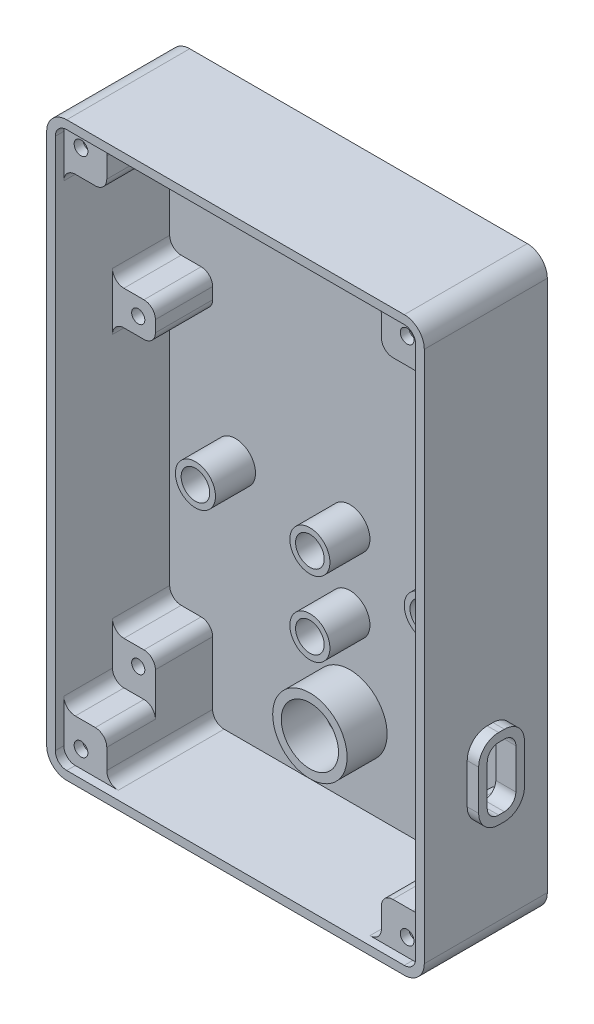
from build123d import *

# Parameters (mm, degrees)
SKETCH_1_W              = 66
SKETCH_1_H              = 100
SKETCH_1_W_2            = 63
SKETCH_1_H_2            = 97
EXTRUDE_1_DEPTH         = 20
SKETCH_3_W              = 66
SKETCH_3_H              = 100
EXTRUDE_2_DEPTH         = 1.5
SKETCH_4_W              = 7.5
SKETCH_4_H              = 6
SKETCH_4_H_2            = 7.5
EXTRUDE_3_DEPTH         = 10
HOLE_WIZARD_M2_21_D     = 2.3
HOLE_WIZARD_M2_21_DEPTH = 4
HOLE_WIZARD_M2_21_TIP   = 0.690989712
SKETCH_8_W              = 7.5
SKETCH_8_H              = 7.5
EXTRUDE_4_DEPTH         = 18.5
FILLET_1_R              = 2
FILLET_3_R              = 2
FILLET_4_R              = 3.5
SKETCH_9_R              = 2.5
SKETCH_9_R_2            = 3.5
CUT_EXTRUDE_1_DEPTH     = 64.158530699
EXTRUDE_START           = 7
SKETCH_10_R             = 3.5
SKETCH_10_R_2           = 2.5
EXTRUDE_5_DEPTH         = 7
SKETCH_11_R             = 2.5
CUT_EXTRUDE_2_DEPTH     = 18.5
HOLE_WIZARD_M21_D       = 2.4
SKETCH_15_W             = 5
SKETCH_15_H             = 11
CUT_EXTRUDE_3_DEPTH     = 85.025293811
FILLET_5_R              = 2
SKETCH_16_R             = 6.5
SKETCH_16_R_2           = 5
EXTRUDE_6_DEPTH         = 7
EXTRUDE_START_2         = 2
EXTRUDE_7_DEPTH         = 2


with BuildPart() as part:
    # Эскиз1 → Бобышка-Вытянуть1 (new body)
    with BuildSketch(Plane.XY):
        Rectangle(SKETCH_1_W, SKETCH_1_H)
        Rectangle(SKETCH_1_W_2, SKETCH_1_H_2, mode=Mode.SUBTRACT)
    extrude(amount=EXTRUDE_1_DEPTH)

    # Эскиз3 → Бобышка-Вытянуть2 (add)
    with BuildSketch(Plane(origin=(0, 0, 0), x_dir=(-1, 0, 0), z_dir=(0, 0, -1))):
        Rectangle(SKETCH_3_W, SKETCH_3_H)
    extrude(amount=EXTRUDE_2_DEPTH)

    # Эскиз4 → Бобышка-Вытянуть3 (add)
    with BuildSketch(Plane.XY):
        with Locations((-27.75, 16.5)):
            Rectangle(SKETCH_4_W, SKETCH_4_H)
        with Locations((27.75, 16.5)):
            Rectangle(SKETCH_4_W, SKETCH_4_H)
        with Locations((-27.75, -37.25)):
            Rectangle(SKETCH_4_W, SKETCH_4_H_2)
        with Locations((27.75, -37.25)):
            Rectangle(SKETCH_4_W, SKETCH_4_H_2)
    extrude(amount=EXTRUDE_3_DEPTH)

    # Сверло под метчик  спиральное M2.21
    with Locations(Plane.XY.offset(10)):
        with Locations((-27, 16.5), (27, 16.5), (27, -36.5), (-27, -36.5)):
            Hole(HOLE_WIZARD_M2_21_D / 2, depth=HOLE_WIZARD_M2_21_DEPTH)
            with Locations((0, 0, -(HOLE_WIZARD_M2_21_DEPTH + HOLE_WIZARD_M2_21_TIP / 2))):  # 118° drill point
                Cone(0, HOLE_WIZARD_M2_21_D / 2, HOLE_WIZARD_M2_21_TIP, mode=Mode.SUBTRACT)

    # Эскиз8 → Бобышка-Вытянуть4 (add)
    with BuildSketch(Plane.XY):
        with Locations((-27.75, 44.75)):
            Rectangle(SKETCH_8_W, SKETCH_8_H)
        with Locations((27.75, 44.75)):
            Rectangle(SKETCH_8_W, SKETCH_8_H)
        with Locations((27.75, -44.75)):
            Rectangle(SKETCH_8_W, SKETCH_8_H)
        with Locations((-27.75, -44.75)):
            Rectangle(SKETCH_8_W, SKETCH_8_H)
    extrude(amount=EXTRUDE_4_DEPTH)

    # Скругление1
    fillet_1_edges = [part.edges().sort_by_distance(p)[0] for p in [
        (-31.5, 41, 9.25),
        (-24, 41, 9.25),
        (-24, 48.5, 9.25),
        (31.5, 41, 9.25),
        (24, 48.5, 9.25),
        (24, 41, 9.25),
        (24, -48.5, 9.25),
        (-24, -48.5, 9.25),
        (-31.5, 19.5, 5),
        (-31.5, 13.5, 5),
        (-24, 13.5, 5),
        (-24, 19.5, 5),
        (31.5, 13.5, 5),
        (31.5, 19.5, 5),
        (24, 19.5, 5),
        (24, 13.5, 5),
        (-31.5, -33.5, 5),
        (-24, -33.5, 5),
        (31.5, -33.5, 5),
        (24, -33.5, 5),
    ]]
    fillet(fillet_1_edges, radius=FILLET_1_R)

    # Скругление3
    fillet_3_edges = [part.edges().sort_by_distance(p)[0] for p in [
        (31.5, -41, 14.25),
        (24, -41, 14.25),
        (-24, -41, 14.25),
        (31.5, -48.5, 19.25),
        (-31.5, -41, 14.25),
        (31.5, 48.5, 19.25),
        (-31.5, 48.5, 19.25),
        (-31.5, -48.5, 19.25),
    ]]
    fillet(fillet_3_edges, radius=FILLET_3_R)

    # Скругление4
    fillet_4_edges = [part.edges().sort_by_distance(p)[0] for p in [
        (33, -50, 9.25),
        (-33, -50, 9.25),
        (-33, 50, 9.25),
        (33, 50, 9.25),
    ]]
    fillet(fillet_4_edges, radius=FILLET_4_R)

    # Эскиз9 → Вырез-Вытянуть1 (cut, through all)
    with BuildSketch(Plane.XY):
        with Locations((-20, -7)):
            Circle(SKETCH_9_R)
        with Locations((20, -7)):
            Circle(SKETCH_9_R)
        with Locations((0, -20)):
            Circle(SKETCH_9_R)
        with Locations((0, -7)):
            Circle(SKETCH_9_R)
        with Locations((0, -35)):
            Circle(SKETCH_9_R_2)
    extrude(amount=-CUT_EXTRUDE_1_DEPTH, mode=Mode.SUBTRACT)

    # Эскиз10 → Бобышка-Вытянуть5 (add)
    # profile 1 of 4: a face of its own
    with BuildSketch(Plane.XY.offset(EXTRUDE_START)):
        with Locations(Location((0, -7, 0), (0, 0, 180))):
            Circle(SKETCH_10_R)
        with Locations((0, -7)):
            Circle(SKETCH_10_R_2, mode=Mode.SUBTRACT)
    # profile 2 of 4: a face of its own
    with BuildSketch(Plane.XY.offset(EXTRUDE_START)):
        with Locations(Location((20, -7, 0), (0, 0, 180))):
            Circle(SKETCH_10_R)
        with Locations((20, -7)):
            Circle(SKETCH_10_R_2, mode=Mode.SUBTRACT)
    # profile 3 of 4: a face of its own
    with BuildSketch(Plane.XY.offset(EXTRUDE_START)):
        with Locations(Location((0, -20, 0), (0, 0, 180))):
            Circle(SKETCH_10_R)
        with Locations((0, -20)):
            Circle(SKETCH_10_R_2, mode=Mode.SUBTRACT)
    # profile 4 of 4: a face of its own
    with BuildSketch(Plane.XY.offset(EXTRUDE_START)):
        with Locations(Location((-20, -7, 0), (0, 0, 180))):
            Circle(SKETCH_10_R)
        with Locations((-20, -7)):
            Circle(SKETCH_10_R_2, mode=Mode.SUBTRACT)
    extrude(amount=-EXTRUDE_5_DEPTH)

    # Эскиз11 → Вырез-Вытянуть2 (cut)
    with BuildSketch(Plane(origin=(0, 0, -1.5), x_dir=(-1, 0, 0), z_dir=(0, 0, -1))):
        with Locations((-28.5, 45.5)):
            Circle(SKETCH_11_R)
        with Locations((28.5, 45.5)):
            Circle(SKETCH_11_R)
        with Locations((28.5, -45.5)):
            Circle(SKETCH_11_R)
        with Locations((-28.5, -45.5)):
            Circle(SKETCH_11_R)
    extrude(amount=-CUT_EXTRUDE_2_DEPTH, mode=Mode.SUBTRACT)

    # Отверстие с зазором M21 (through all)
    with Locations(Plane(origin=(0, 0, 17), x_dir=(-1, 0, 0), z_dir=(0, 0, -1))):
        with Locations((-28.5, 45.5), (28.5, 45.5), (28.5, -45.5), (-28.5, -45.5)):
            Hole(HOLE_WIZARD_M21_D / 2)

    # Эскиз15 → Вырез-Вытянуть3 (cut, through all)
    with BuildSketch(Plane.ZY.offset(-31.5)):
        with Locations((8.5, -23)):
            Rectangle(SKETCH_15_W, SKETCH_15_H)
    extrude(amount=-CUT_EXTRUDE_3_DEPTH, mode=Mode.SUBTRACT)

    # Скругление5
    fillet_5_edges = [part.edges().sort_by_distance(p)[0] for p in [
        (32.25, -28.5, 6),
        (32.25, -17.5, 6),
        (32.25, -17.5, 11),
        (32.25, -28.5, 11),
    ]]
    fillet(fillet_5_edges, radius=FILLET_5_R)

    # Эскиз16 → Бобышка-Вытянуть6 (add)
    with BuildSketch(Plane.XY):
        with Locations(Location((0, -35, 0), (0, 0, 180))):
            Circle(SKETCH_16_R)
        with Locations((0, -35)):
            Circle(SKETCH_16_R_2, mode=Mode.SUBTRACT)
    extrude(amount=EXTRUDE_6_DEPTH)

    # Эскиз19 → Бобышка-Вытянуть7 (add)
    with BuildSketch(Plane(origin=(33, 0, 0), x_dir=(0, 0, -1), z_dir=(1, 0, 0)).offset(EXTRUDE_START_2)):
        with BuildLine():
            Line((-4.5, -26.5), (-4.5, -19.5))
            ThreePointArc((-4.5, -19.5), (-5.525126266, -17.025126266), (-8, -16))
            Line((-8, -16), (-9, -16))
            ThreePointArc((-9, -16), (-11.474873734, -17.025126266), (-12.5, -19.5))
            Line((-12.5, -19.5), (-12.5, -26.5))
            ThreePointArc((-12.5, -26.5), (-11.474873734, -28.974873734), (-9, -30))
            Line((-9, -30), (-8, -30))
            ThreePointArc((-8, -30), (-5.525126266, -28.974873734), (-4.5, -26.5))
        make_face()
        with BuildLine():
            Line((-11, -19.5), (-11, -26.5))
            ThreePointArc((-11, -26.5), (-10.414213562, -27.914213562), (-9, -28.5))
            Line((-9, -28.5), (-8, -28.5))
            ThreePointArc((-8, -28.5), (-6.585786438, -27.914213562), (-6, -26.5))
            Line((-6, -26.5), (-6, -19.5))
            ThreePointArc((-6, -19.5), (-6.585786438, -18.085786438), (-8, -17.5))
            Line((-8, -17.5), (-9, -17.5))
            ThreePointArc((-9, -17.5), (-10.414213562, -18.085786438), (-11, -19.5))
        make_face(mode=Mode.SUBTRACT)
    extrude(amount=-EXTRUDE_7_DEPTH)


solid = part.part
